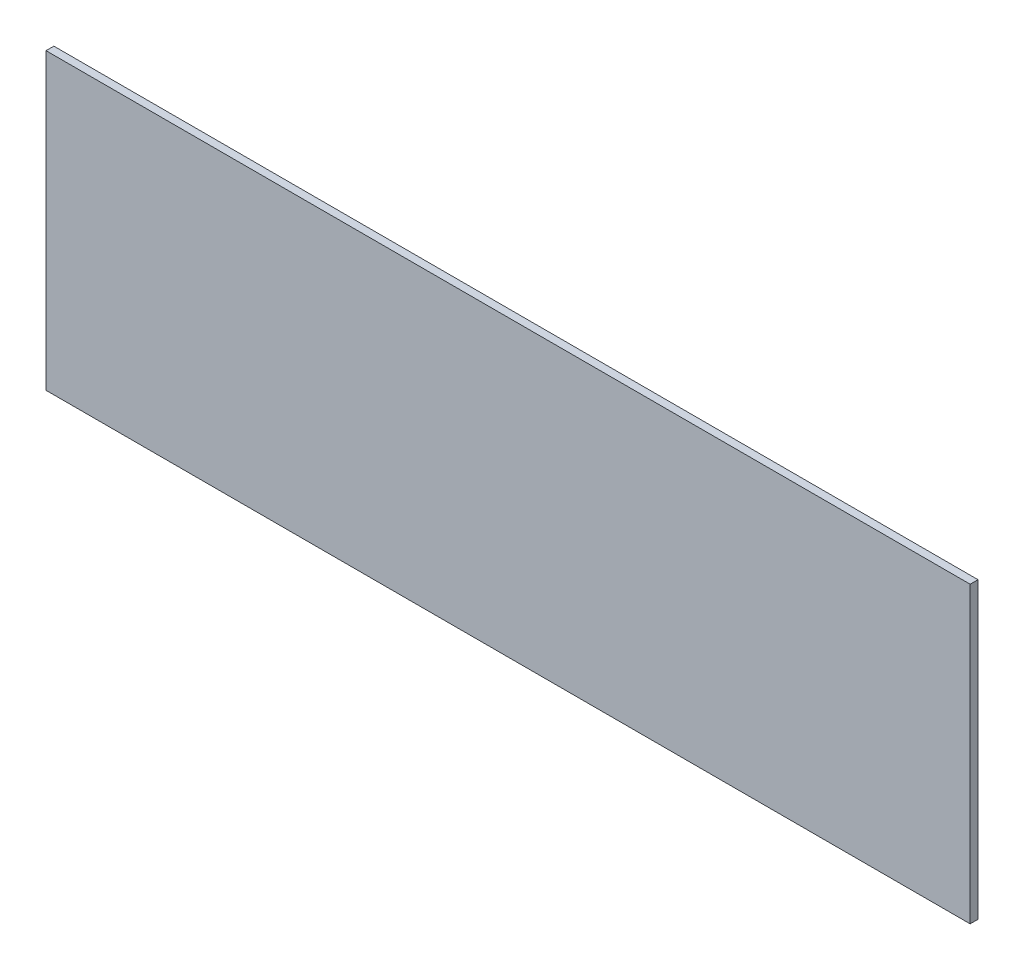
from build123d import *

# Parameters (mm, degrees)
SKETCH1_W           = 188.5
SKETCH1_H           = 60
BOSS_EXTRUDE1_DEPTH = 1.6


with BuildPart() as part:
    # Sketch1 → Boss-Extrude1 (new body)
    with BuildSketch(Plane.XY):
        Rectangle(SKETCH1_W, SKETCH1_H)
    extrude(amount=BOSS_EXTRUDE1_DEPTH)


solid = part.part
